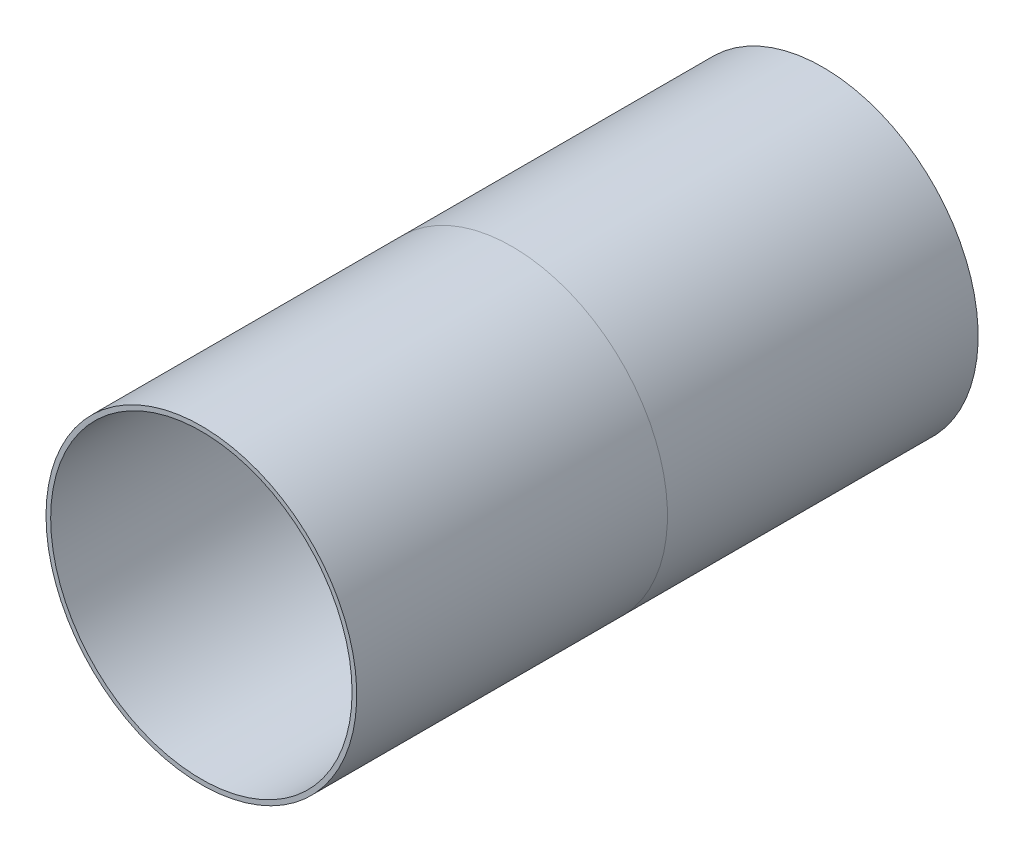
from build123d import *

# Parameters (mm, degrees)
ESQUISSE2_R        = 76.1746
ESQUISSE2_R_2      = 73.914
BOSS_EXTRU_1_DEPTH = 152.4
ESQUISSE3_R        = 76.2
ESQUISSE3_R_2      = 73.914
BOSS_EXTRU_2_DEPTH = 152.4


with BuildPart() as part:
    # Esquisse2 → Boss.-Extru.1 (new body)
    with BuildSketch(Plane.XY):
        with Locations(Location((0, 0, 0), (0, 0, 180))):
            Circle(ESQUISSE2_R)
        with Locations(Location((0, 0, 0), (0, 0, 180))):
            Circle(ESQUISSE2_R_2, mode=Mode.SUBTRACT)
    extrude(amount=BOSS_EXTRU_1_DEPTH)

    # Esquisse3 → Boss.-Extru.2 (add)
    with BuildSketch(Plane.XY.offset(152.4)):
        with Locations(Location((0, 0, 0), (0, 0, 180))):
            Circle(ESQUISSE3_R)
        with Locations(Location((0, 0, 0), (0, 0, 180))):
            Circle(ESQUISSE3_R_2, mode=Mode.SUBTRACT)
    extrude(amount=BOSS_EXTRU_2_DEPTH)


solid = part.part
